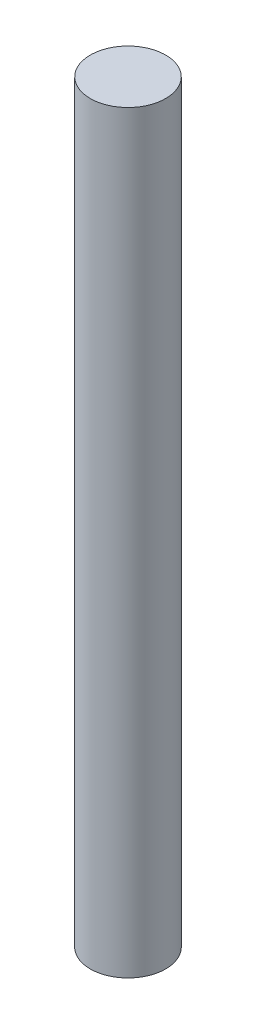
from build123d import *

# Parameters (mm, degrees)
SKETCH1_R           = 5
BOSS_EXTRUDE1_DEPTH = 100


with BuildPart() as part:
    # Sketch1 → Boss-Extrude1 (new body)
    with BuildSketch(Plane(origin=(0, 0, 0), x_dir=(1, 0, 0), z_dir=(0, 1, 0))):
        with Locations(Location((-6.3553695, -10.017724353, 0), (0, 0, 270))):
            Circle(SKETCH1_R)
    extrude(amount=BOSS_EXTRUDE1_DEPTH)


solid = part.part
